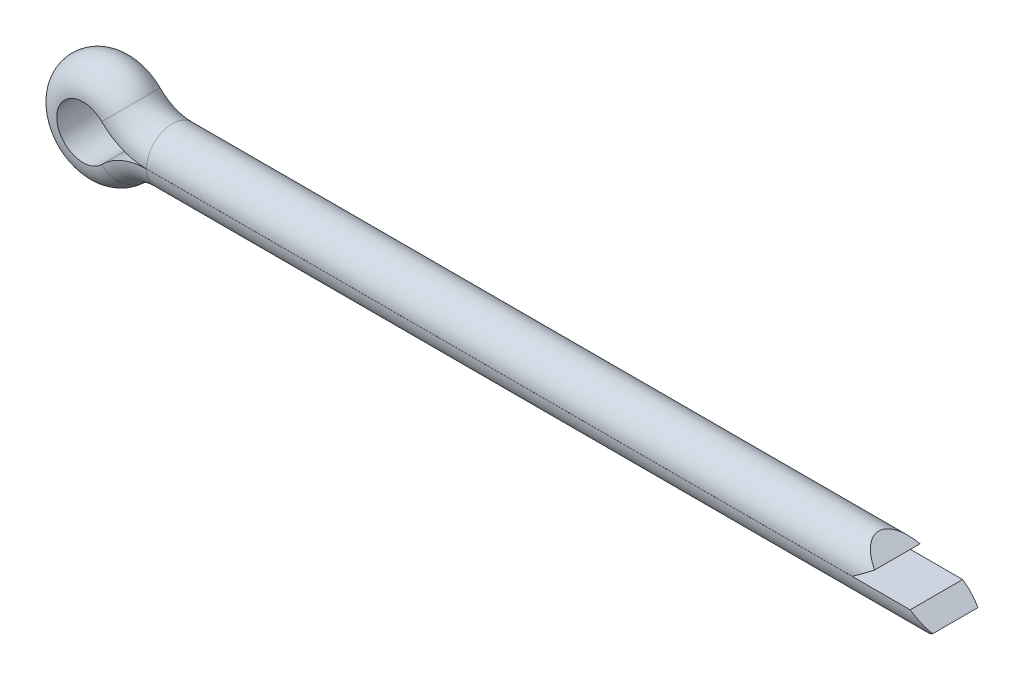
from build123d import *

# Parameters (mm, degrees)
CONECUT_DEPTH      = 44.321501554
CONECUT_DEPTH_BACK = 44.321501554


with BuildPart() as part:
    # Body: sweep along a path in PathSke
    with BuildLine(Plane.XY) as body_path:
        Line((40, 1.45), (0, 1.45))
        ThreePointArc((0, 1.45), (-0.784287723, 1.606029633), (-1.449137781, 2.050357081))
        ThreePointArc((-1.449137781, 2.050357081), (-6.4, 0), (-1.449137781, -2.050357081))
        ThreePointArc((-1.449137781, -2.050357081), (-0.784287723, -1.606029633), (0, -1.45))
        Line((0, -1.45), (43.2, -1.45))
    # SectionSke → Body (sweep)
    with BuildSketch(Plane(origin=(40, 0, 0), x_dir=(0, 0, -1), z_dir=(1, 0, 0))):
        with BuildLine():
            Line((-1.449998621, 0.002), (1.449998621, 0.002))
            ThreePointArc((1.449998621, 0.002), (0, 1.45), (-1.449998621, 0.002))
        make_face()
    sweep(path=body_path.line)

    # ConeCutSke → ConeCut (cut, two sides: drawn at the far end of the back side and taken through both)
    with BuildSketch(Plane.XY.offset(-CONECUT_DEPTH_BACK)):
        Polygon((40, 0.726), (38.960252785, 1.46), (43.21, 1.46), (43.21, -1.46), (42.160252785, -1.46), (43.2, -0.726), (42.154651125, 0), (38.954651125, 0), align=None)
    extrude(amount=CONECUT_DEPTH + CONECUT_DEPTH_BACK, mode=Mode.SUBTRACT)


solid = part.part
